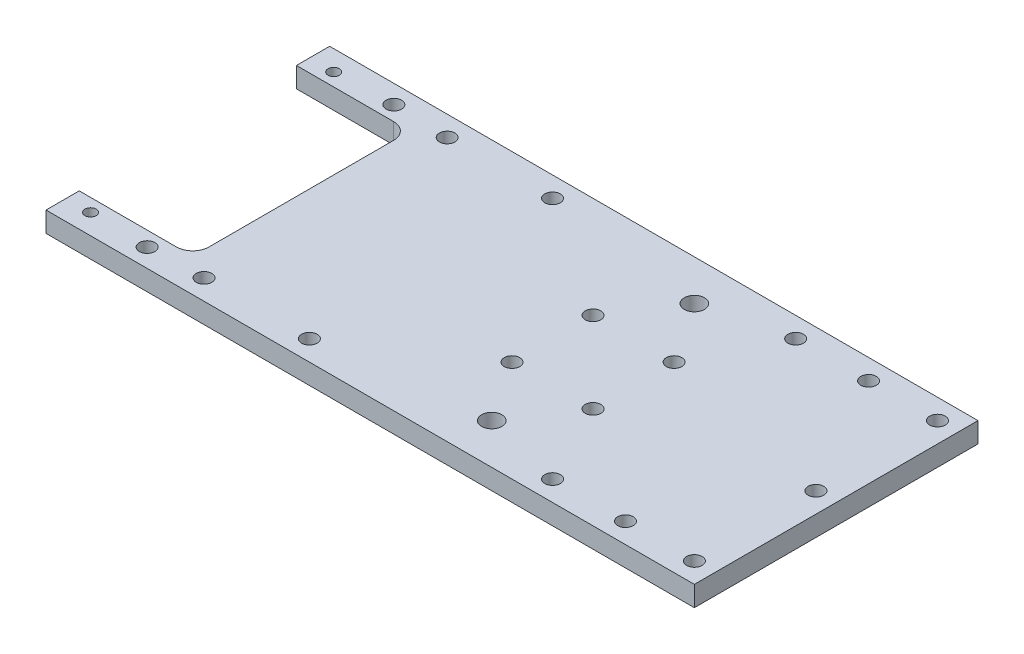
from build123d import *

# Parameters (mm, degrees)
SKETCH1_W           = 101.6
SKETCH1_H           = 44.45
BOSS_EXTRUDE1_DEPTH = 3.175
SKETCH2_R           = 0.889
SKETCH2_R_2         = 1.2192
CUT_EXTRUDE1_DEPTH  = 56.539816798
SKETCH3_R           = 1.2192
SKETCH3_R_2         = 1.5875
CUT_EXTRUDE2_DEPTH  = 56.539816798
SKETCH4_W           = 17.78
SKETCH4_H           = 34.036
CUT_EXTRUDE3_DEPTH  = 56.539816798
FILLET2_R           = 2.54


with BuildPart() as part:
    # Sketch1 → Boss-Extrude1 (new body)
    with BuildSketch(Plane(origin=(0, 0, 0), x_dir=(1, 0, 0), z_dir=(0, 1, 0))):
        Rectangle(SKETCH1_W, SKETCH1_H)
    extrude(amount=BOSS_EXTRUDE1_DEPTH)

    # Sketch2 → Cut-Extrude1 (cut, through all)
    with BuildSketch(Plane(origin=(0, 3.175, 0), x_dir=(1, 0, 0), z_dir=(0, 1, 0))):
        with Locations(Location((-46.99, 19.05, 0), (0, 0, 270))):
            Circle(SKETCH2_R)
        with Locations(Location((-29.21, 19.05, 0), (0, 0, 270))):
            Circle(SKETCH2_R_2)
        with Locations(Location((-12.7, 19.05, 0), (0, 0, 270))):
            Circle(SKETCH2_R_2)
        with Locations(Location((25.4, 19.05, 0), (0, 0, 270))):
            Circle(SKETCH2_R_2)
        with Locations(Location((36.83, 19.05, 0), (0, 0, 270))):
            Circle(SKETCH2_R_2)
        with Locations(Location((47.625, 19.05, 0), (0, 0, 270))):
            Circle(SKETCH2_R_2)
        with Locations(Location((47.625, 0, 0), (0, 0, 270))):
            Circle(SKETCH2_R_2)
        with Locations(Location((47.625, -19.05, 0), (0, 0, 270))):
            Circle(SKETCH2_R_2)
        with Locations(Location((36.83, -19.05, 0), (0, 0, 270))):
            Circle(SKETCH2_R_2)
        with Locations(Location((25.4, -19.05, 0), (0, 0, 270))):
            Circle(SKETCH2_R_2)
        with Locations(Location((-12.7, -19.05, 0), (0, 0, 270))):
            Circle(SKETCH2_R_2)
        with Locations(Location((-29.21, -19.05, 0), (0, 0, 270))):
            Circle(SKETCH2_R_2)
        with Locations(Location((-46.99, -19.05, 0), (0, 0, 270))):
            Circle(SKETCH2_R)
        with Locations(Location((19.05, -6.35, 0), (0, 0, 270))):
            Circle(SKETCH2_R_2)
        with Locations(Location((19.05, 6.35, 0), (0, 0, 270))):
            Circle(SKETCH2_R_2)
        with Locations(Location((6.35, 6.35, 0), (0, 0, 270))):
            Circle(SKETCH2_R_2)
        with Locations(Location((6.35, -6.35, 0), (0, 0, 270))):
            Circle(SKETCH2_R_2)
    extrude(amount=-CUT_EXTRUDE1_DEPTH, mode=Mode.SUBTRACT)

    # Sketch3 → Cut-Extrude2 (cut, through all)
    with BuildSketch(Plane(origin=(0, 3.175, 0), x_dir=(1, 0, 0), z_dir=(0, 1, 0))):
        with Locations(Location((-37.846, 19.3294, 0), (0, 0, 270))):
            Circle(SKETCH3_R)
        with Locations(Location((12.7, 15.875, 0), (0, 0, 270))):
            Circle(SKETCH3_R_2)
    cut_extrude2 = extrude(amount=-CUT_EXTRUDE2_DEPTH, mode=Mode.SUBTRACT)

    # Mirror1: Cut-Extrude2 across plane
    add(cut_extrude2.mirror(Plane.XY), mode=Mode.SUBTRACT)

    # Sketch4 → Cut-Extrude3 (cut, through all)
    with BuildSketch(Plane(origin=(0, 3.175, 0), x_dir=(1, 0, 0), z_dir=(0, 1, 0))):
        with Locations((-41.91, 0)):
            Rectangle(SKETCH4_W, SKETCH4_H)
    extrude(amount=-CUT_EXTRUDE3_DEPTH, mode=Mode.SUBTRACT)

    # Fillet2
    fillet2_edges = [part.edges().sort_by_distance(p)[0] for p in [
        (-33.02, 1.5875, -17.018),
        (-33.02, 1.5875, 17.018),
    ]]
    fillet(fillet2_edges, radius=FILLET2_R)


solid = part.part
